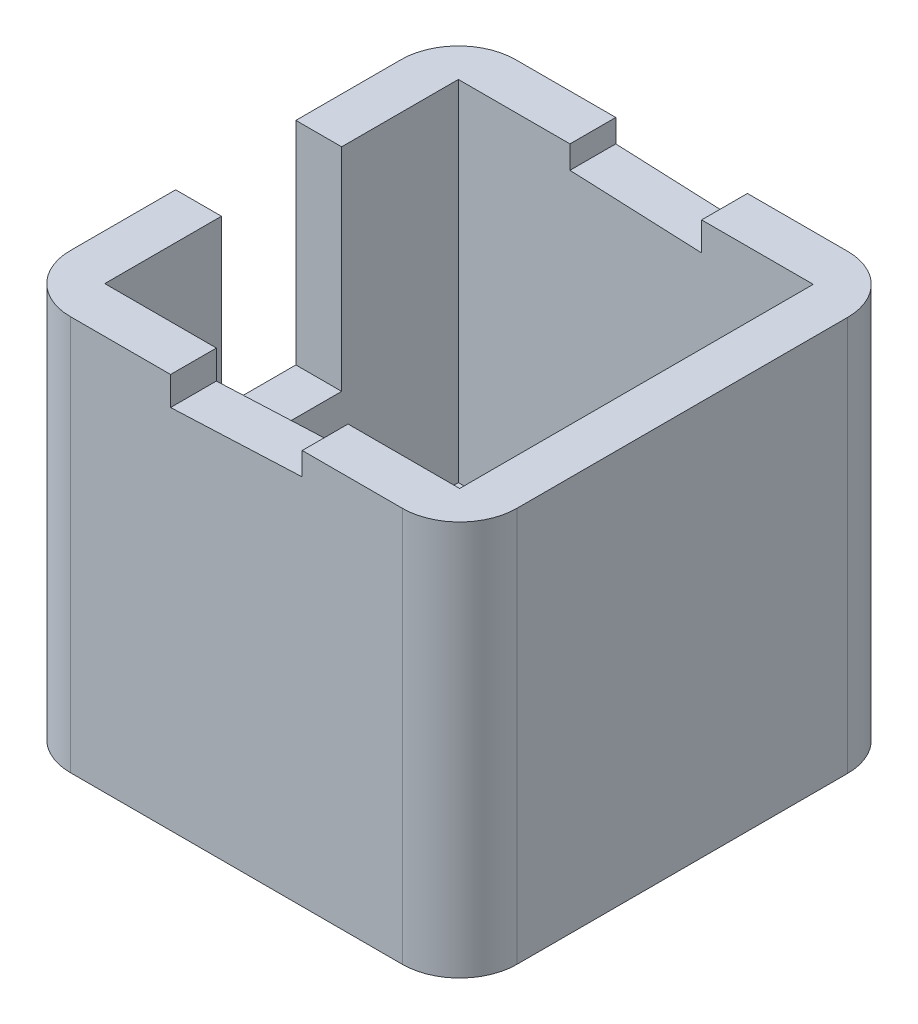
from build123d import *

# Parameters (mm, degrees)
SKETCH1_W            = 62
SKETCH1_H            = 61.770504471
BOSS_EXTRUDE6_DEPTH  = 8
SKETCH1_15_W         = 78
SKETCH1_15_H         = 77.770504471
SKETCH1_15_W_2       = 62
SKETCH1_15_H_2       = 61.770504471
BOSS_EXTRUDE9_DEPTH  = 69
SKETCH1_17_R         = 4
CUT_EXTRUDE2_DEPTH   = 56
SKETCH1_18_R         = 4
SKETCH1_18_R_2       = 2
BOSS_EXTRUDE10_DEPTH = 4
FILLET3_R            = 10
CUT_EXTRUDE10_DEPTH  = 8
CUT_EXTRUDE11_DEPTH  = 8
SKETCH6_W            = 21
SKETCH6_H            = 37
CUT_EXTRUDE13_DEPTH  = 10


with BuildPart() as part:
    # Sketch1 → Boss-Extrude6 (new body)
    with BuildSketch(Plane(origin=(0, 0, 0), x_dir=(1, 0, 0), z_dir=(0, 1, 0))):
        with Locations((31, 30.885252236)):
            Rectangle(SKETCH1_W, SKETCH1_H)
    extrude(amount=BOSS_EXTRUDE6_DEPTH)

    # Sketch1<15> → Boss-Extrude9 (add)
    with BuildSketch(Plane(origin=(0, 0, 0), x_dir=(1, 0, 0), z_dir=(0, 1, 0))):
        with Locations((31, 30.885252236)):
            Rectangle(SKETCH1_15_W, SKETCH1_15_H)
        with Locations((31, 30.885252236)):
            Rectangle(SKETCH1_15_W_2, SKETCH1_15_H_2, mode=Mode.SUBTRACT)
    extrude(amount=BOSS_EXTRUDE9_DEPTH)

    # Sketch1<17> → Cut-Extrude2 (cut)
    with BuildSketch(Plane(origin=(0, 0, 0), x_dir=(1, 0, 0), z_dir=(0, 1, 0))):
        with Locations((5.656854249, 56.113650222)):
            Circle(SKETCH1_17_R)
        with Locations((56.343145751, 56.113650222)):
            Circle(SKETCH1_17_R)
        with Locations((56.343145751, 5.656854249)):
            Circle(SKETCH1_17_R)
        with Locations((5.656854249, 5.656854249)):
            Circle(SKETCH1_17_R)
    extrude(amount=CUT_EXTRUDE2_DEPTH, mode=Mode.SUBTRACT)

    # Sketch1<18> → Boss-Extrude10 (add)
    # profile 1 of 4: a face of its own
    with BuildSketch(Plane(origin=(0, 0, 0), x_dir=(1, 0, 0), z_dir=(0, 1, 0))):
        with Locations((5.656854249, 56.113650222)):
            Circle(SKETCH1_18_R)
        with Locations((5.656854249, 56.113650222)):
            Circle(SKETCH1_18_R_2, mode=Mode.SUBTRACT)
    # profile 2 of 4: a face of its own
    with BuildSketch(Plane(origin=(0, 0, 0), x_dir=(1, 0, 0), z_dir=(0, 1, 0))):
        with Locations((56.343145751, 56.113650222)):
            Circle(SKETCH1_18_R)
        with Locations((56.343145751, 56.113650222)):
            Circle(SKETCH1_18_R_2, mode=Mode.SUBTRACT)
    # profile 3 of 4: a face of its own
    with BuildSketch(Plane(origin=(0, 0, 0), x_dir=(1, 0, 0), z_dir=(0, 1, 0))):
        with Locations((56.343145751, 5.656854249)):
            Circle(SKETCH1_18_R)
        with Locations((56.343145751, 5.656854249)):
            Circle(SKETCH1_18_R_2, mode=Mode.SUBTRACT)
    # profile 4 of 4: a face of its own
    with BuildSketch(Plane(origin=(0, 0, 0), x_dir=(1, 0, 0), z_dir=(0, 1, 0))):
        with Locations((5.656854249, 5.656854249)):
            Circle(SKETCH1_18_R)
        with Locations((5.656854249, 5.656854249)):
            Circle(SKETCH1_18_R_2, mode=Mode.SUBTRACT)
    extrude(amount=BOSS_EXTRUDE10_DEPTH)

    # Fillet3
    fillet3_edges = [part.edges().sort_by_distance(p)[0] for p in [
        (70, 34.5, -69.770504471),
        (-8, 34.5, -69.770504471),
        (-8, 34.5, 8),
        (70, 34.5, 8),
    ]]
    fillet(fillet3_edges, radius=FILLET3_R)

    # Sketch3 → Cut-Extrude10 (cut)
    with BuildSketch(Plane(origin=(0, 0, -69.770504471), x_dir=(-1, 0, 0), z_dir=(0, 0, -1))):
        Polygon((-42.5, 69), (-42.5, 64), (-19.5, 65), (-19.5, 69), align=None)
    extrude(amount=-CUT_EXTRUDE10_DEPTH, mode=Mode.SUBTRACT)

    # Sketch9 → Cut-Extrude11 (cut)
    with BuildSketch(Plane.XY.offset(8)):
        Polygon((19.5, 69), (19.5, 64), (42.5, 65), (42.5, 69), align=None)
    extrude(amount=-CUT_EXTRUDE11_DEPTH, mode=Mode.SUBTRACT)

    # Sketch6 → Cut-Extrude13 (cut)
    with BuildSketch(Plane.ZY.offset(8)):
        with Locations((-30.885252236, 50.5)):
            Rectangle(SKETCH6_W, SKETCH6_H)
    extrude(amount=-CUT_EXTRUDE13_DEPTH, mode=Mode.SUBTRACT)


solid = part.part
